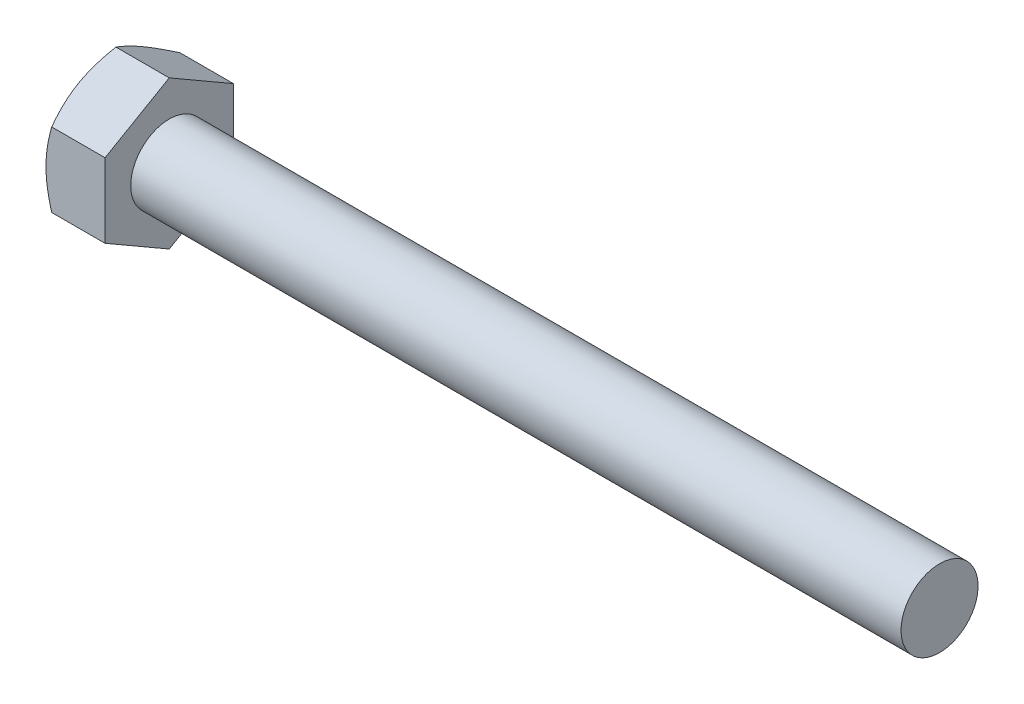
from build123d import *

# Parameters (mm, degrees)
SKETCH2_R     = 2.915704388
HEX_DIE_DEPTH = 2.3
SKETCH4_R     = 2.1875
INDENT_DEPTH  = 0.2875


with BuildPart() as part:
    # BodySke → Base-Revolve (revolve)
    with BuildSketch(Plane.XY, mode=Mode.PRIVATE) as base_revolve_sk:
        Polygon((2.3, 1.5), (2.3, 2.886836028), (0.223339885, 2.886836028), (0, 2.5), (0, 0), (32.3, 0), (32.3, 1.5), align=None)
    revolve(base_revolve_sk.sketch.rotate(Axis((-25.4, 0, 0), (1, 0, 0)), 90), axis=Axis((-25.4, 0, 0), (1, 0, 0)))

    # Sketch2 → Hex-Die (cut)
    with BuildSketch(Plane(origin=(0, 0, 0), x_dir=(0, 0, -1), z_dir=(1, 0, 0))):
        Circle(SKETCH2_R)
        Polygon((-2.5, 1.443375679), (0, 2.886751359), (2.5, 1.443375679), (2.5, -1.443375679), (0, -2.886751359), (-2.5, -1.443375679), align=None, mode=Mode.SUBTRACT)
    extrude(amount=HEX_DIE_DEPTH, mode=Mode.SUBTRACT)

    # Sketch4 → Indent (cut)
    with BuildSketch(Plane(origin=(0, 0, 0), x_dir=(0, 0, -1), z_dir=(1, 0, 0))):
        Circle(SKETCH4_R)
    extrude(amount=INDENT_DEPTH, mode=Mode.SUBTRACT)


solid = part.part
